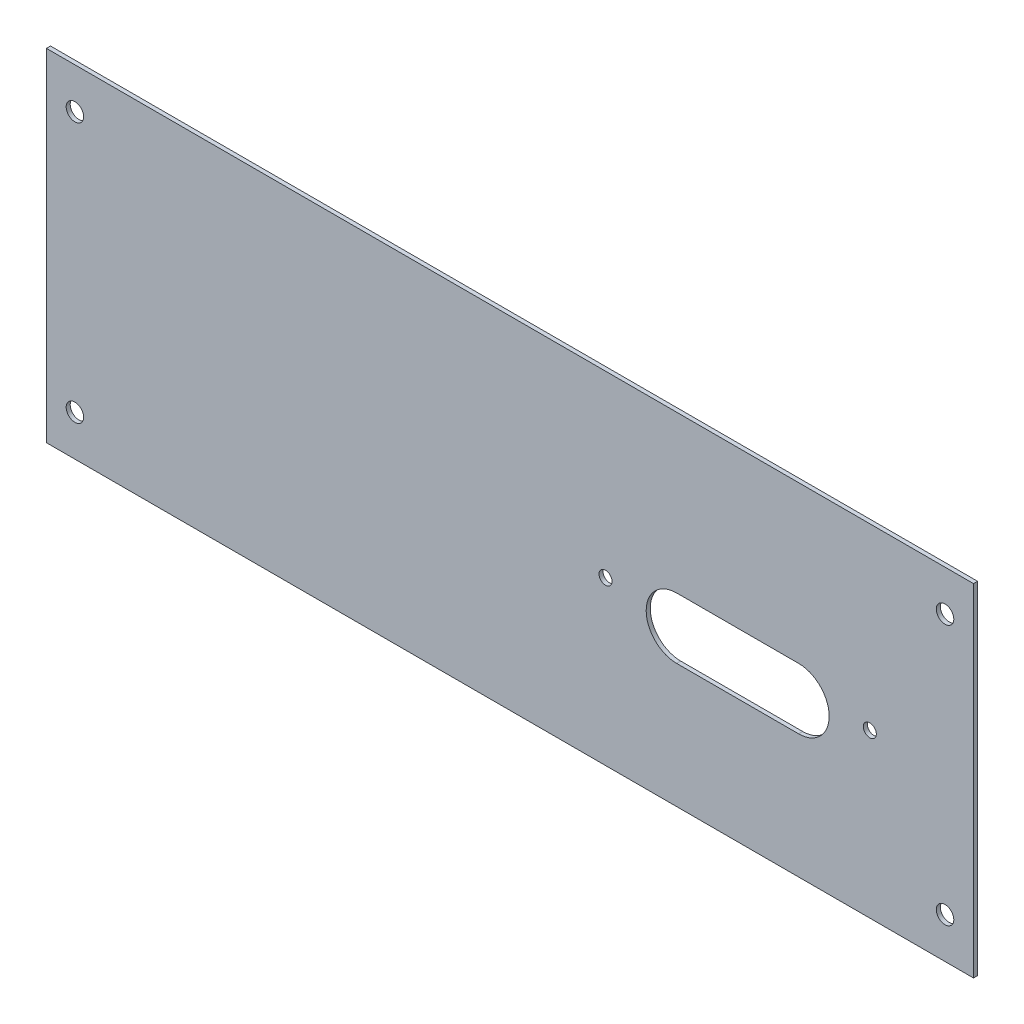
from build123d import *

# Parameters (mm, degrees)
SKETCH_1_W      = 228
SKETCH_1_H      = 84
SKETCH_1_R      = 1.6
SKETCH_1_R_2    = 2.15
EXTRUDE_1_DEPTH = 1


with BuildPart() as part:
    # Эскиз1 → Вытянуть1 (new body)
    with BuildSketch(Plane.XY):
        Rectangle(SKETCH_1_W, SKETCH_1_H)
        with Locations((23.5, -2)):
            Circle(SKETCH_1_R, mode=Mode.SUBTRACT)
        with Locations((107, 32)):
            Circle(SKETCH_1_R_2, mode=Mode.SUBTRACT)
        with Locations(Location((-107, 32, 0), (0, 0, 180))):
            Circle(SKETCH_1_R_2, mode=Mode.SUBTRACT)
        with Locations((-107, -32)):
            Circle(SKETCH_1_R_2, mode=Mode.SUBTRACT)
        with Locations(Location((107, -32, 0), (0, 0, 180))):
            Circle(SKETCH_1_R_2, mode=Mode.SUBTRACT)
        with Locations((88.5, -2)):
            Circle(SKETCH_1_R, mode=Mode.SUBTRACT)
        with BuildLine():
            Line((41, 3.5), (71, 3.5))
            ThreePointArc((71, 3.5), (78.5, -4), (71, -11.5))
            Line((71, -11.5), (41, -11.5))
            ThreePointArc((41, -11.5), (33.5, -4), (41, 3.5))
        make_face(mode=Mode.SUBTRACT)
    extrude(amount=EXTRUDE_1_DEPTH)


solid = part.part
